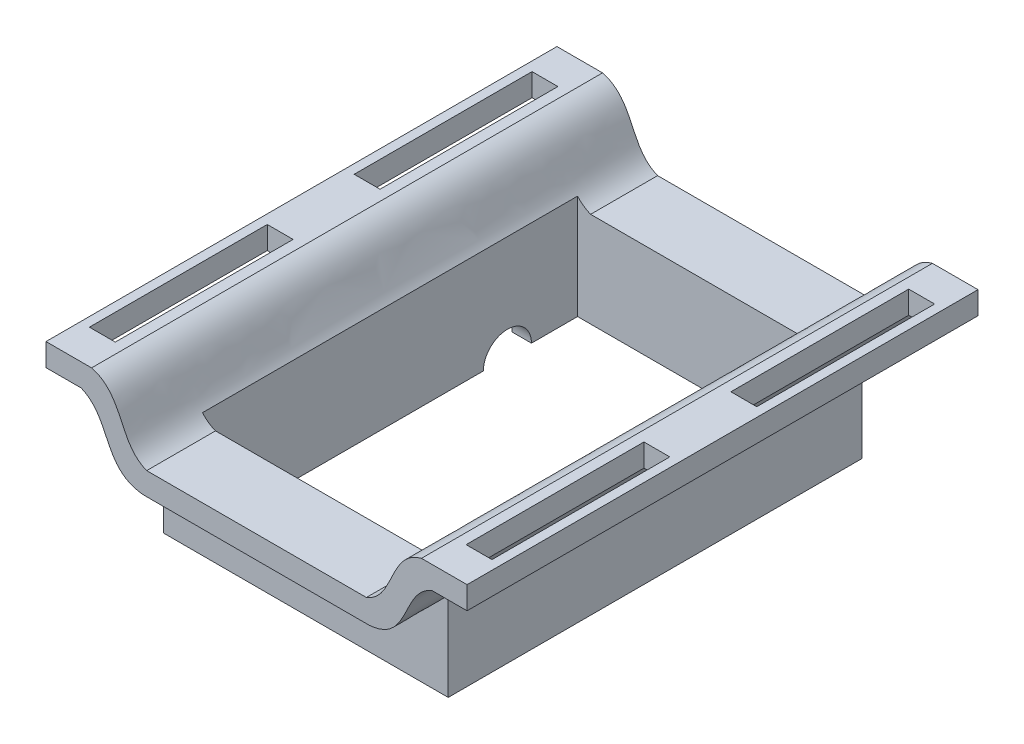
from build123d import *

# Parameters (mm, degrees)
BOSS_EXTRUDE1_DEPTH = 79
SKETCH2_W           = 38
SKETCH2_H           = 58
CUT_EXTRUDE1_DEPTH  = 79
SKETCH2_4_W         = 44
SKETCH2_4_H         = 64
SKETCH2_4_W_2       = 38
SKETCH2_4_H_2       = 58
BOSS_EXTRUDE2_DEPTH = 11.2
BOSS_EXTRUDE3_REACH = 88.426
BOSS_EXTRUDE4_REACH = 88.426
SKETCH3_W           = 4
SKETCH3_H           = 27.5
CUT_EXTRUDE2_DEPTH  = 11.2
SKETCH4_R           = 3.719736595
CUT_EXTRUDE3_DEPTH  = 11.2


with BuildPart() as part:
    # Sketch1 → Boss-Extrude1 (new body)
    with BuildSketch(Plane.XY):
        with BuildLine():
            add(Edge.make_bspline(
                [(-25.5, -5.5), (-23.231190988, -6.092136591), (-20.857183856, -9.763256189), (-19.405733653, -14.032473401), (-16.986240344, -15)],
                knots=[0, 0, 0, 0, 0.466176326, 1, 1, 1, 1], degree=3))
            Line((-25.5, -5.5), (-32.550427966, -5.5))
            Line((-32.550427966, -5.5), (-32.550427966, -9))
            Line((-32.550427966, -9), (-27.122212975, -9))
            add(Edge.make_bspline(
                [(-27.122212975, -9), (-22.380611745, -10.95479786), (-23.823298098, -17.968578536), (-17.452262353, -18.5)],
                knots=[0, 0, 0, 0, 1, 1, 1, 1], degree=3))
            Line((-17.452262353, -18.5), (17.452262353, -18.5))
            add(Edge.make_bspline(
                [(27.122212975, -9), (22.380611745, -10.95479786), (23.823298098, -17.968578536), (17.452262353, -18.5)],
                knots=[0, 0, 0, 0, 1, 1, 1, 1], degree=3))
            Line((27.122212975, -9), (32.550427966, -9))
            Line((32.550427966, -9), (32.550427966, -5.5))
            Line((32.550427966, -5.5), (25.5, -5.5))
            add(Edge.make_bspline(
                [(25.5, -5.5), (23.231190988, -6.092136591), (20.857183856, -9.763256189), (19.405733653, -14.032473401), (16.986240344, -15)],
                knots=[0, 0, 0, 0, 0.466176326, 1, 1, 1, 1], degree=3))
            Line((16.986240344, -15), (-16.986240344, -15))
        make_face()
    extrude(amount=BOSS_EXTRUDE1_DEPTH)

    # Sketch2 → Cut-Extrude1 (cut)
    with BuildSketch(Plane.XZ.offset(18.5)):
        with Locations((0, 39.360513879)):
            Rectangle(SKETCH2_W, SKETCH2_H)
    extrude(amount=-CUT_EXTRUDE1_DEPTH, mode=Mode.SUBTRACT)

    # Sketch2<4> → Boss-Extrude2 (add)
    with BuildSketch(Plane.XZ.offset(18.5)):
        with Locations((0, 39.360513879)):
            Rectangle(SKETCH2_4_W, SKETCH2_4_H)
        with Locations((0, 39.360513879)):
            Rectangle(SKETCH2_4_W_2, SKETCH2_4_H_2, mode=Mode.SUBTRACT)
    extrude(amount=BOSS_EXTRUDE2_DEPTH)

    # Sketch2<8> → Boss-Extrude3 (add, up to next)
    with BuildSketch(Plane.XZ.offset(18.5), mode=Mode.PRIVATE) as boss_extrude3_sk1:
        Polygon((-19, 10.360513879), (-19, 68.360513879), (-17.452262353, 68.360513879), (-17.452262353, 71.360513879), (-22, 71.360513879), (-22, 7.360513879), (-17.452262353, 7.360513879), (-17.452262353, 10.360513879), align=None)
    boss_extrude3_tool1 = extrude(boss_extrude3_sk1.sketch, amount=-BOSS_EXTRUDE3_REACH, mode=Mode.PRIVATE) - part.part
    add(boss_extrude3_tool1.solids().sort_by_distance((-20.395094, -18.5, 39.360514))[0])

    # Sketch2<9> → Boss-Extrude4 (add, up to next)
    with BuildSketch(Plane.XZ.offset(18.5), mode=Mode.PRIVATE) as boss_extrude4_sk1:
        Polygon((17.452262353, 71.360513879), (17.452262353, 68.360513879), (19, 68.360513879), (19, 10.360513879), (17.452262353, 10.360513879), (17.452262353, 7.360513879), (22, 7.360513879), (22, 71.360513879), align=None)
    boss_extrude4_tool1 = extrude(boss_extrude4_sk1.sketch, amount=-BOSS_EXTRUDE4_REACH, mode=Mode.PRIVATE) - part.part
    add(boss_extrude4_tool1.solids().sort_by_distance((20.395094, -18.5, 39.360514))[0])

    # Sketch3 → Cut-Extrude2 (cut)
    with BuildSketch(Plane.XZ.offset(9)):
        with Locations((29.122212975, 59.969493631)):
            Rectangle(SKETCH3_W, SKETCH3_H)
        with Locations((29.122212975, 19.030506369)):
            Rectangle(SKETCH3_W, SKETCH3_H)
    cut_extrude2 = extrude(amount=-CUT_EXTRUDE2_DEPTH, mode=Mode.SUBTRACT)

    # Mirror1: Cut-Extrude2 across plane
    add(cut_extrude2.mirror(Plane(origin=(0, 0, 0), x_dir=(0, 0, 1), z_dir=(1, 0, 0))), mode=Mode.SUBTRACT)

    # Sketch4 → Cut-Extrude3 (cut)
    with BuildSketch(Plane.ZY.offset(22)):
        with Locations((21.211295074, -29.7)):
            Circle(SKETCH4_R)
    extrude(amount=-CUT_EXTRUDE3_DEPTH, mode=Mode.SUBTRACT)


solid = part.part
